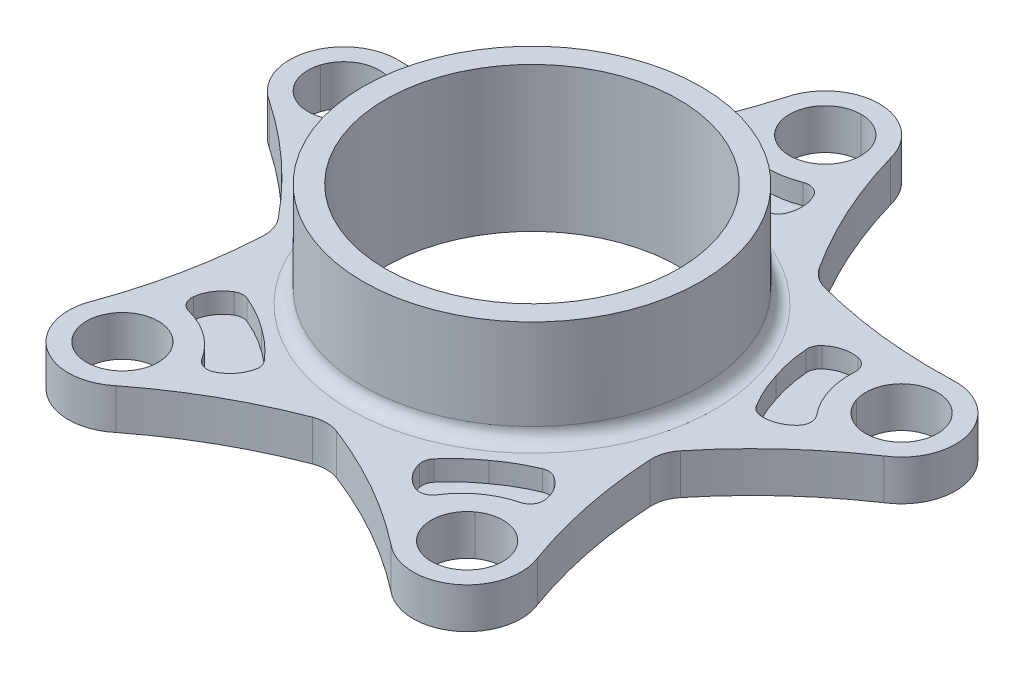
from build123d import *

# Parameters (mm, degrees)
SKETCH1_R                 = 31.75
CENTERCIRCLEEXTRUDE_DEPTH = 19.558
SKETCH2_R                 = 80.01
BASEEXPAND_DEPTH          = 7.62
SKETCH3_R                 = 27.559
CENTERCUT_DEPTH           = 27.178
SKETCH4_R                 = 6.731
OUTERCIRCLECUT_DEPTH      = 7.62
SKETCH8_R                 = 80.01
STARFISHCUT_DEPTH         = 7.62
FILLET8_R                 = 2.54
BATMAN_CUT_DEPTH          = 3.81
FILLET11_R                = 2.54
FILLET12_R                = 6.35


with BuildPart() as part:
    # Sketch1 → CenterCircleExtrude (new body)
    with BuildSketch(Plane(origin=(0, 0, 0), x_dir=(1, 0, 0), z_dir=(0, 1, 0))):
        Circle(SKETCH1_R)
    extrude(amount=CENTERCIRCLEEXTRUDE_DEPTH)

    # Sketch2 → BaseExpand (add)
    with BuildSketch(Plane.XZ):
        Circle(SKETCH2_R)
    extrude(amount=BASEEXPAND_DEPTH)

    # Sketch3 → CenterCut (cut)
    with BuildSketch(Plane(origin=(0, 19.558, 0), x_dir=(1, 0, 0), z_dir=(0, 1, 0))):
        Circle(SKETCH3_R)
    extrude(amount=-CENTERCUT_DEPTH, mode=Mode.SUBTRACT)

    # Sketch4 → OuterCircleCut (cut)
    with BuildSketch(Plane(origin=(0, 0, 0), x_dir=(1, 0, 0), z_dir=(0, 1, 0))):
        with Locations((0, 55.118)):
            Circle(SKETCH4_R)
        with Locations((52.420333065, 17.032398696)):
            Circle(SKETCH4_R)
        with Locations((32.397547536, -44.591398696)):
            Circle(SKETCH4_R)
        with Locations((-32.397547536, -44.591398696)):
            Circle(SKETCH4_R)
        with Locations((-52.420333065, 17.032398696)):
            Circle(SKETCH4_R)
    extrude(amount=-OUTERCIRCLECUT_DEPTH, mode=Mode.SUBTRACT)

    # Sketch8 → StarfishCut (cut)
    with BuildSketch(Plane(origin=(0, 0, 0), x_dir=(1, 0, 0), z_dir=(0, 1, 0))):
        Circle(SKETCH8_R)
        with BuildLine():
            ThreePointArc((-58.392231228, 8.812786033), (-62.083067271, 20.172011359), (-52.420333065, 27.192398696))
            ThreePointArc((-52.420333065, 27.192398696), (-52.037198375, 27.185172101), (-51.654608717, 27.163502595))
            ThreePointArc((-51.654608717, 27.163502595), (-36.896277117, 27.85004837), (-22.436174146, 30.88074446))
            ThreePointArc((-22.436174146, 30.88074446), (-15.085393323, 43.69658302), (-9.871874218, 57.520436145))
            ThreePointArc((-9.871874218, 57.520436145), (-9.774256435, 57.890996779), (-9.662734206, 58.257612663))
            ThreePointArc((-9.662734206, 58.257612663), (0, 65.278), (9.662734206, 58.257612663))
            ThreePointArc((9.662734206, 58.257612663), (9.774256435, 57.890996779), (9.871874218, 57.520436145))
            ThreePointArc((9.871874218, 57.520436145), (15.085393323, 43.69658302), (22.436174146, 30.88074446))
            ThreePointArc((22.436174146, 30.88074446), (36.896277117, 27.85004837), (51.654608717, 27.163502595))
            ThreePointArc((51.654608717, 27.163502595), (52.037198375, 27.185172101), (52.420333065, 27.192398696))
            ThreePointArc((52.420333065, 27.192398696), (59.604537962, 24.216603593), (62.580333065, 17.032398696))
            ThreePointArc((62.580333065, 17.032398696), (61.472959351, 12.419855219), (58.392231228, 8.812786033))
            ThreePointArc((58.392231228, 8.812786033), (58.078021067, 8.593431551), (57.755762516, 8.38608199))
            ThreePointArc((57.755762516, 8.38608199), (46.219562925, -0.844074872), (36.302492346, -11.795394786))
            ThreePointArc((36.302492346, -11.795394786), (37.88854664, -26.484306539), (41.79617808, -40.732468288))
            ThreePointArc((41.79617808, -40.732468288), (41.935013711, -41.08963643), (42.060281741, -41.451786033))
            ThreePointArc((42.060281741, -41.451786033), (42.432461076, -43.002024531), (42.557547536, -44.591398696))
            ThreePointArc((42.557547536, -44.591398696), (37.010091013, -53.644024982), (26.425649373, -52.811011359))
            ThreePointArc((26.425649373, -52.811011359), (26.119934583, -52.579964), (25.823150063, -52.337552443))
            ThreePointArc((25.823150063, -52.337552443), (13.479867509, -44.21824998), (0, -38.170699348))
            ThreePointArc((0, -38.170699348), (-13.479867509, -44.21824998), (-25.823150063, -52.337552443))
            ThreePointArc((-25.823150063, -52.337552443), (-26.119934583, -52.579964), (-26.425649373, -52.811011359))
            ThreePointArc((-26.425649373, -52.811011359), (-38.369445699, -52.811011359), (-42.060281741, -41.451786033))
            ThreePointArc((-42.060281741, -41.451786033), (-41.935013711, -41.08963643), (-41.79617808, -40.732468288))
            ThreePointArc((-41.79617808, -40.732468288), (-37.88854664, -26.484306539), (-36.302492346, -11.795394786))
            ThreePointArc((-36.302492346, -11.795394786), (-46.219562925, -0.844074872), (-57.755762516, 8.38608199))
            ThreePointArc((-57.755762516, 8.38608199), (-58.078021067, 8.593431551), (-58.392231228, 8.812786033))
        make_face(mode=Mode.SUBTRACT)
    extrude(amount=-STARFISHCUT_DEPTH, mode=Mode.SUBTRACT)

    # Fillet8
    fillet8_edges = [part.edges().sort_by_distance(p)[0] for p in [
        (-31.75, 0, 0),
    ]]
    fillet(fillet8_edges, radius=FILLET8_R)

    # Sketch14 → Batman Cut (cut)
    with BuildSketch(Plane(origin=(0, 0, 0), x_dir=(1, 0, 0), z_dir=(0, 1, 0))):
        with BuildLine():
            ThreePointArc((38.21208836, 3.61640796), (36.123298629, 7.295617591), (34.592844745, 11.239896606))
            ThreePointArc((34.592844745, 11.239896606), (33.51261891, 15.330463583), (33.039900139, 19.534766499))
            ThreePointArc((33.039900139, 19.534766499), (36.998616208, 21.99136873), (41.568556549, 21.08474162))
            ThreePointArc((41.568556549, 21.08474162), (42.072446101, 13.670166407), (46.022968853, 7.375470207))
            ThreePointArc((46.022968853, 7.375470207), (42.858711498, 3.955849931), (38.21208836, 3.61640796))
        make_face()
        with BuildLine():
            ThreePointArc((7.207390506, 46.049590062), (0, 44.237587757), (-7.207390506, 46.049590062))
            ThreePointArc((-7.207390506, 46.049590062), (-9.481833356, 41.983481706), (-8.368776337, 37.459387154))
            ThreePointArc((-8.368776337, 37.459387154), (-4.224168519, 36.609768371), (0, 36.373069478))
            ThreePointArc((0, 36.373069478), (4.224168519, 36.609768371), (8.368776337, 37.459387154))
            ThreePointArc((8.368776337, 37.459387154), (9.481833356, 41.983481706), (7.207390506, 46.049590062))
        make_face()
        with BuildLine():
            ThreePointArc((15.24759305, -35.224324117), (18.101257819, -32.100828731), (21.37955382, -29.426431345))
            ThreePointArc((21.37955382, -29.426431345), (24.936106057, -27.135020814), (28.788557608, -25.386237496))
            ThreePointArc((28.788557608, -25.386237496), (32.348235709, -28.392068372), (32.898171317, -33.018503097))
            ThreePointArc((32.898171317, -33.018503097), (26.00220168, -35.788960285), (21.236368508, -41.491298791))
            ThreePointArc((21.236368508, -41.491298791), (17.006307064, -39.538631994), (15.24759305, -35.224324117))
        make_face()
        with BuildLine():
            ThreePointArc((-28.788557608, -25.386237496), (-24.936106057, -27.135020814), (-21.37955382, -29.426431345))
            ThreePointArc((-21.37955382, -29.426431345), (-18.101257819, -32.100828731), (-15.24759305, -35.224324117))
            ThreePointArc((-15.24759305, -35.224324117), (-17.006307064, -39.538631994), (-21.236368508, -41.491298791))
            ThreePointArc((-21.236368508, -41.491298791), (-26.00220168, -35.788960285), (-32.898171317, -33.018503097))
            ThreePointArc((-32.898171317, -33.018503097), (-32.348235709, -28.392068372), (-28.788557608, -25.386237496))
        make_face()
        with BuildLine():
            ThreePointArc((-33.039900139, 19.534766499), (-33.51261891, 15.330463583), (-34.592844745, 11.239896606))
            ThreePointArc((-34.592844745, 11.239896606), (-36.123298629, 7.295617591), (-38.21208836, 3.61640796))
            ThreePointArc((-38.21208836, 3.61640796), (-42.858711498, 3.955849931), (-46.022968853, 7.375470207))
            ThreePointArc((-46.022968853, 7.375470207), (-42.072446101, 13.670166407), (-41.568556549, 21.08474162))
            ThreePointArc((-41.568556549, 21.08474162), (-36.998616208, 21.99136873), (-33.039900139, 19.534766499))
        make_face()
    extrude(amount=-BATMAN_CUT_DEPTH, mode=Mode.SUBTRACT)

    # Fillet11
    fillet11_edges = [part.edges().sort_by_distance(p)[0] for p in [
        (21.236368508, -1.905, 41.491298791),
        (32.898171317, -1.905, 33.018503097),
        (28.788557608, -1.905, 25.386237496),
        (15.24759305, -1.905, 35.224324117),
        (-21.236368508, -1.905, 41.491298791),
        (-32.898171317, -1.905, 33.018503097),
        (-15.24759305, -1.905, 35.224324117),
        (-28.788557608, -1.905, 25.386237496),
        (-38.21208836, -1.905, -3.61640796),
        (-46.022968853, -1.905, -7.375470207),
        (-33.039900139, -1.905, -19.534766499),
        (-41.568556549, -1.905, -21.08474162),
        (38.21208836, -1.905, -3.61640796),
        (33.039900139, -1.905, -19.534766499),
        (46.022968853, -1.905, -7.375470207),
        (41.568556549, -1.905, -21.08474162),
        (-8.368776337, -1.905, -37.459387154),
        (8.368776337, -1.905, -37.459387154),
        (-7.207390506, -1.905, -46.049590062),
        (7.207390506, -1.905, -46.049590062),
    ]]
    fillet(fillet11_edges, radius=FILLET11_R)

    # Fillet12
    fillet12_edges = [part.edges().sort_by_distance(p)[0] for p in [
        (0, -3.81, 38.170699348),
        (36.302492346, -3.81, 11.795394786),
        (22.436174146, -3.81, -30.88074446),
        (-22.436174146, -3.81, -30.88074446),
        (-36.302492346, -3.81, 11.795394786),
    ]]
    fillet(fillet12_edges, radius=FILLET12_R)


solid = part.part
